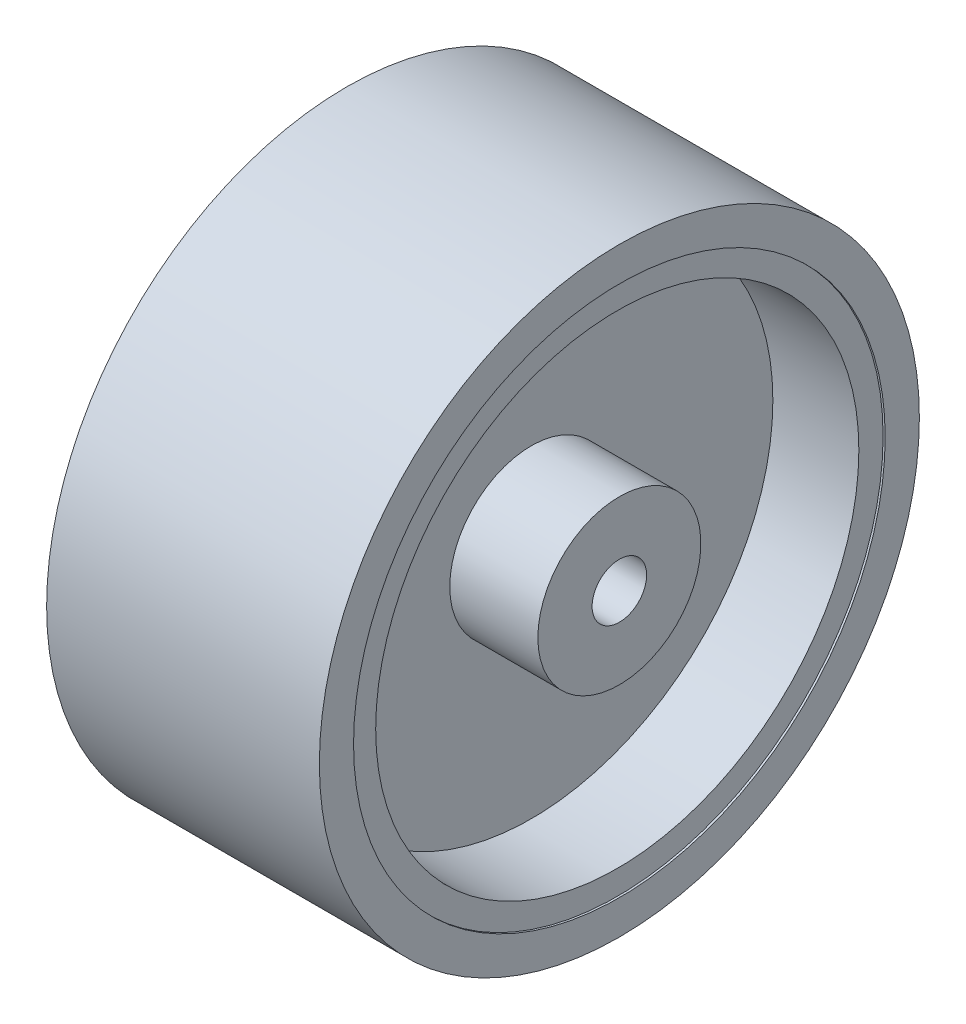
from build123d import *


with BuildPart() as part:
    # Sketch1 → Revolve1 (revolve)
    with BuildSketch(Plane.XY, mode=Mode.PRIVATE) as revolve1_sk:
        Polygon((-12.5, 27.5), (12.5, 27.5), (12.5, 24.366296014), (12.307622825, 24.366296014), (12.307622825, 22.144801265), (4.425648175, 22.144801265), (4.425648175, 7.471496174), (12.5, 7.471496174), (12.5, 2.5), (-12.5, 2.5), (-12.5, 7.471496174), (-4.425648175, 7.471496174), (-4.425648175, 22.144801265), (-12.307622825, 22.144801265), (-12.307622825, 24.366296014), (-12.5, 24.366296014), align=None)
    revolve(revolve1_sk.sketch.rotate(Axis((-44.60448737, 0, 0), (1, 0, 0)), 90), axis=Axis((-44.60448737, 0, 0), (1, 0, 0)))


solid = part.part
